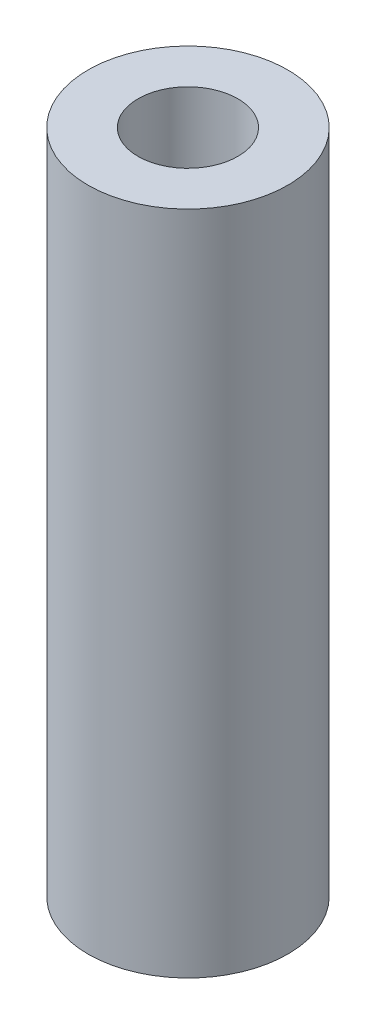
from build123d import *

# Parameters (mm, degrees)
SKETCH1_R           = 3
SKETCH1_R_2         = 1.5
BOSS_EXTRUDE1_DEPTH = 20


with BuildPart() as part:
    # Sketch1 → Boss-Extrude1 (new body)
    with BuildSketch(Plane(origin=(0, 0, 0), x_dir=(1, 0, 0), z_dir=(0, 1, 0))):
        with Locations(Location((0, 0, 0), (0, 0, 270))):
            Circle(SKETCH1_R)
        with Locations(Location((0, 0, 0), (0, 0, 270))):
            Circle(SKETCH1_R_2, mode=Mode.SUBTRACT)
    extrude(amount=BOSS_EXTRUDE1_DEPTH)


solid = part.part
